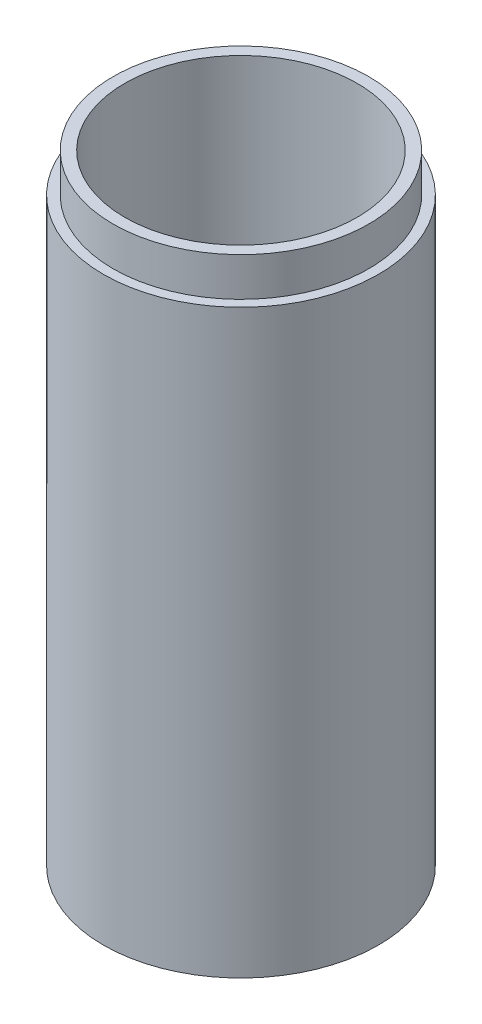
from build123d import *

# Parameters (mm, degrees)
SKETCH1_R           = 17.75
SKETCH1_R_2         = 15
BOSS_EXTRUDE1_DEPTH = 75
SKETCH2_R           = 16.5
SKETCH2_R_2         = 15
BOSS_EXTRUDE2_DEPTH = 5


with BuildPart() as part:
    # Sketch1 → Boss-Extrude1 (new body)
    with BuildSketch(Plane(origin=(0, 0, 0), x_dir=(1, 0, 0), z_dir=(0, 1, 0))):
        with Locations(Location((0, 0, 0), (0, 0, 270))):
            Circle(SKETCH1_R)
        with Locations(Location((0, 0, 0), (0, 0, 270))):
            Circle(SKETCH1_R_2, mode=Mode.SUBTRACT)
    extrude(amount=BOSS_EXTRUDE1_DEPTH)

    # Sketch2 → Boss-Extrude2 (add)
    with BuildSketch(Plane(origin=(0, 75, 0), x_dir=(1, 0, 0), z_dir=(0, 1, 0))):
        with Locations(Location((0, 0, 0), (0, 0, 270))):
            Circle(SKETCH2_R)
        with Locations(Location((0, 0, 0), (0, 0, 270))):
            Circle(SKETCH2_R_2, mode=Mode.SUBTRACT)
    extrude(amount=BOSS_EXTRUDE2_DEPTH)


solid = part.part
